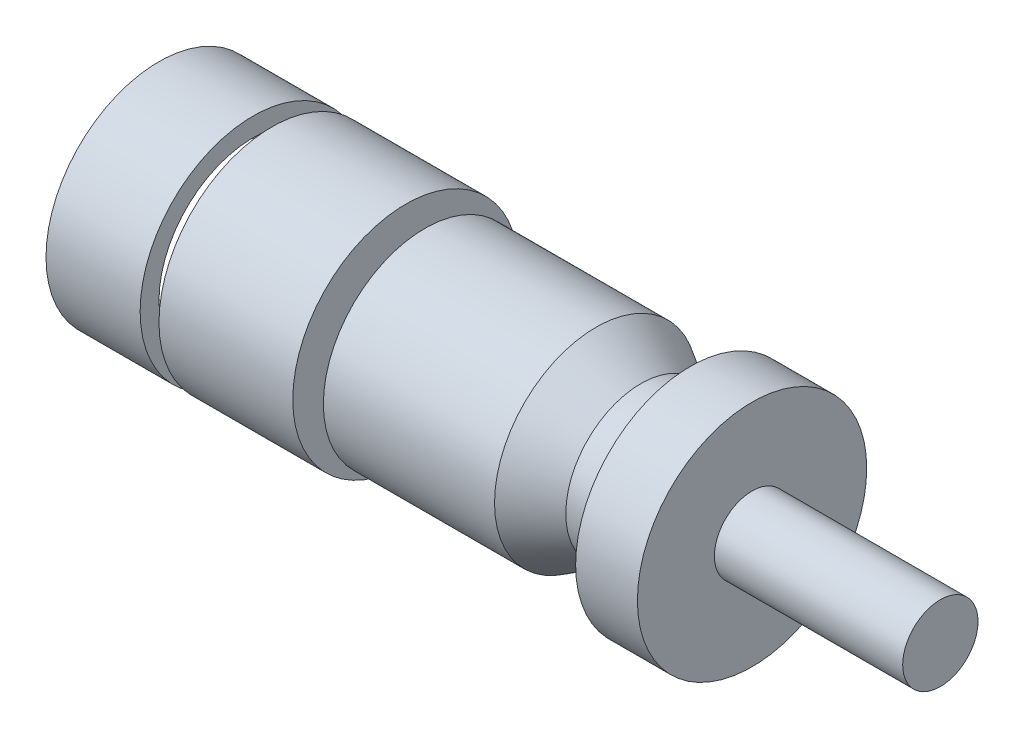
from build123d import *

# Parameters (mm, degrees)
SKETCH_2_R          = 10
CUT_EXTRUDE_1_DEPTH = 10
SKETCH_3_R          = 4
EXTRUDE_1_DEPTH     = 20


with BuildPart() as part:
    # 草图1 → 旋转1 (revolve)
    with BuildSketch(Plane.XY, mode=Mode.PRIVATE) as revolve_1_sk:
        Polygon((0, 0), (0, 12), (10, 12), (10, 5.171378426), (12, 5.171378426), (12, 12), (26.213590289, 12), (26.213590289, 5.171378426), (28.258117979, 5.171378426), (28.258117979, 10.795188001), (46.438305119, 10.795188001), (51.194621956, 7.981109143), (56.437846762, 7.981109143), (56.437846762, 12.17955734), (63, 12.17955734), (63, 0), align=None)
    revolve(revolve_1_sk.sketch.rotate(Axis((0, 0, 0), (1, 0, 0)), 90), axis=Axis((0, 0, 0), (1, 0, 0)))

    # 草图2 → 切除-拉伸1 (cut)
    with BuildSketch(Plane.ZY):
        Circle(SKETCH_2_R)
    extrude(amount=-CUT_EXTRUDE_1_DEPTH, mode=Mode.SUBTRACT)


with BuildPart() as cut_extrude_1_piece_1:
    # of the separate pieces the step leaves, piece 1, a body of its own (cut_extrude_1_pieces)
    add(part.part.solids().sort_by_distance((10, 0, 5.171378426))[0])

    # 草图3 → 凸台-拉伸1 (add)
    with BuildSketch(Plane(origin=(63, 0, 0), x_dir=(0, 0, -1), z_dir=(1, 0, 0))):
        with Locations(Location((0, 0, 0), (0, 0, 180))):
            Circle(SKETCH_3_R)
    extrude(amount=EXTRUDE_1_DEPTH)


with BuildPart() as cut_extrude_1_piece_2:
    # of the separate pieces the step leaves, piece 2, a body of its own (cut_extrude_1_pieces)
    add(part.part.solids().sort_by_distance((0, 0, 12))[0])


solid = Compound([cut_extrude_1_piece_1.part, cut_extrude_1_piece_2.part])
